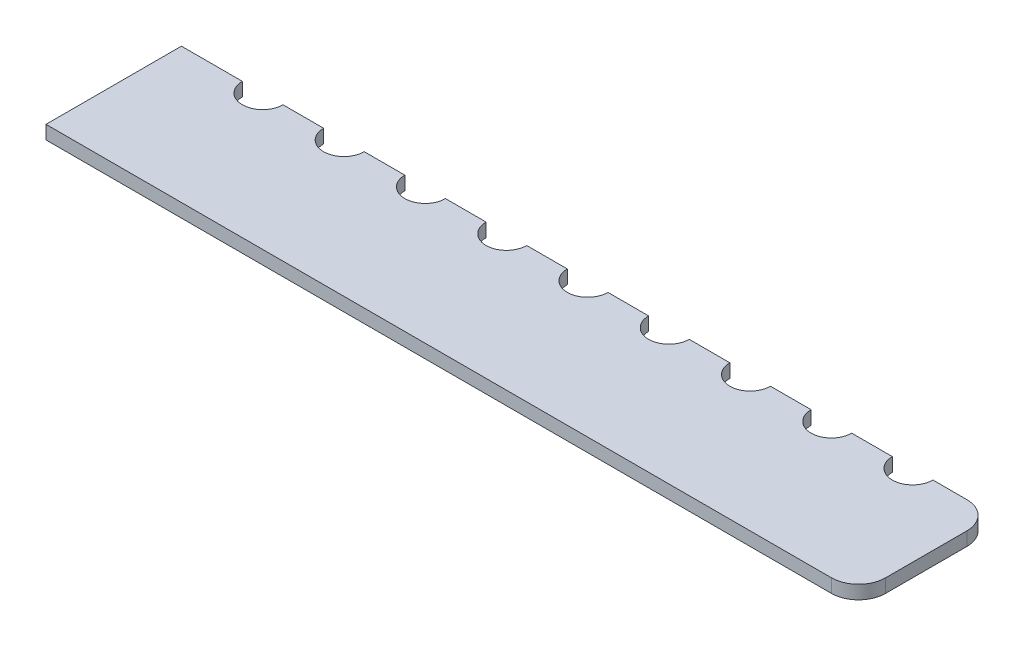
from build123d import *

# Parameters (mm, degrees)
SKETCH1_W           = 300
SKETCH1_H           = 50
BOSS_EXTRUDE1_DEPTH = 5
SKETCH2_R           = 7.5
CUT_EXTRUDE1_DEPTH  = 5
LPATTERN1_COUNT     = 9
LPATTERN1_PITCH     = 30
FILLET2_R           = 10


with BuildPart() as part:
    # Sketch1 → Boss-Extrude1 (new body)
    with BuildSketch(Plane(origin=(0, 0, 0), x_dir=(1, 0, 0), z_dir=(0, 1, 0))):
        with Locations((-150, 25)):
            Rectangle(SKETCH1_W, SKETCH1_H)
    extrude(amount=BOSS_EXTRUDE1_DEPTH)

    # Sketch2 → Cut-Extrude1 (cut)
    with BuildSketch(Plane(origin=(0, 5, 0), x_dir=(1, 0, 0), z_dir=(0, 1, 0))):
        with Locations((-270, 50)):
            Circle(SKETCH2_R)
    cut_extrude1 = extrude(amount=-CUT_EXTRUDE1_DEPTH, mode=Mode.SUBTRACT)

    # LPattern1: Cut-Extrude1 ×9
    with Locations(*[(i * LPATTERN1_PITCH, 0, 0) for i in range(1, LPATTERN1_COUNT)]):
        add(cut_extrude1, mode=Mode.SUBTRACT)

    # Fillet2
    fillet2_edges = [part.edges().sort_by_distance(p)[0] for p in [
        (0, 2.5, 0),
        (0, 2.5, -50),
    ]]
    fillet(fillet2_edges, radius=FILLET2_R)


solid = part.part
